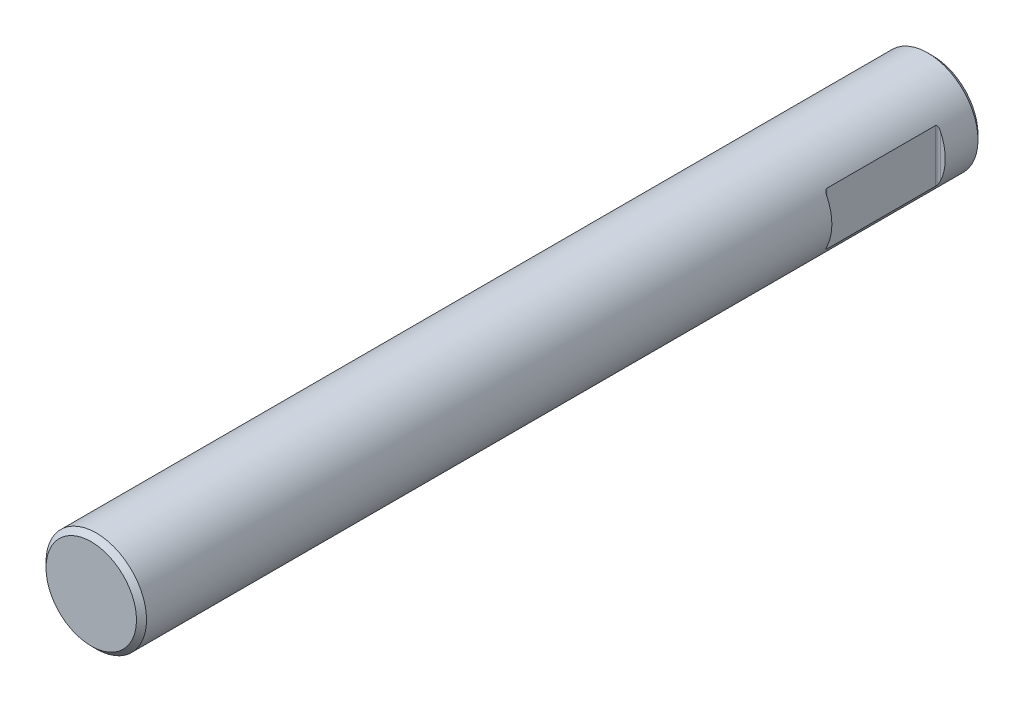
from build123d import *

# Parameters (mm, degrees)
SKIZZE1_W                            = 33.4
SKIZZE1_H                            = 1.995
FASE1_SIZE                           = 0.2
SCHNITT_LINEAR_AUSTRAGEN1_DEPTH      = 34.51895061
SCHNITT_LINEAR_AUSTRAGEN1_DEPTH_BACK = 34.51895061


with BuildPart() as part:
    # Skizze1 → Rotation1 (revolve)
    with BuildSketch(Plane(origin=(0, 0, 0), x_dir=(0, 0, -1), z_dir=(1, 0, 0))):
        with Locations((16.7, 0.9975)):
            Rectangle(SKIZZE1_W, SKIZZE1_H)
    revolve(axis=Axis((0, 0, 50.516901408), (0, 0, -1)))

    # Fase1
    fase1_edges = [part.edges().sort_by_distance(p)[0] for p in [
        (0, -1.995, -33.4),
        (0, -1.995, 0),
    ]]
    chamfer(fase1_edges, length=FASE1_SIZE)

    # Skizze2 → Schnitt-Linear austragen1 (cut, two sides: drawn at the far end of the back side and taken through both)
    with BuildSketch(Plane(origin=(0, 0, 0), x_dir=(1, 0, 0), z_dir=(0, 1, 0)).offset(-SCHNITT_LINEAR_AUSTRAGEN1_DEPTH_BACK)):
        with BuildLine():
            Line((-6.2, 27.4), (-1.8, 27.4))
            ThreePointArc((-1.8, 27.4), (-1.729289322, 27.429289322), (-1.7, 27.5))
            Line((-1.7, 27.5), (-1.7, 31.8))
            ThreePointArc((-1.7, 31.8), (-1.729289322, 31.870710678), (-1.8, 31.9))
            Line((-1.8, 31.9), (-6.2, 31.9))
            Line((-6.2, 31.9), (-6.2, 27.4))
        make_face()
        with BuildLine():
            Line((1.7, 27.5), (1.7, 31.8))
            ThreePointArc((1.7, 31.8), (1.729289322, 31.870710678), (1.8, 31.9))
            Line((1.8, 31.9), (6.2, 31.9))
            Line((6.2, 31.9), (6.2, 27.4))
            Line((6.2, 27.4), (1.8, 27.4))
            ThreePointArc((1.8, 27.4), (1.729289322, 27.429289322), (1.7, 27.5))
        make_face()
    extrude(amount=SCHNITT_LINEAR_AUSTRAGEN1_DEPTH + SCHNITT_LINEAR_AUSTRAGEN1_DEPTH_BACK, mode=Mode.SUBTRACT)


solid = part.part
